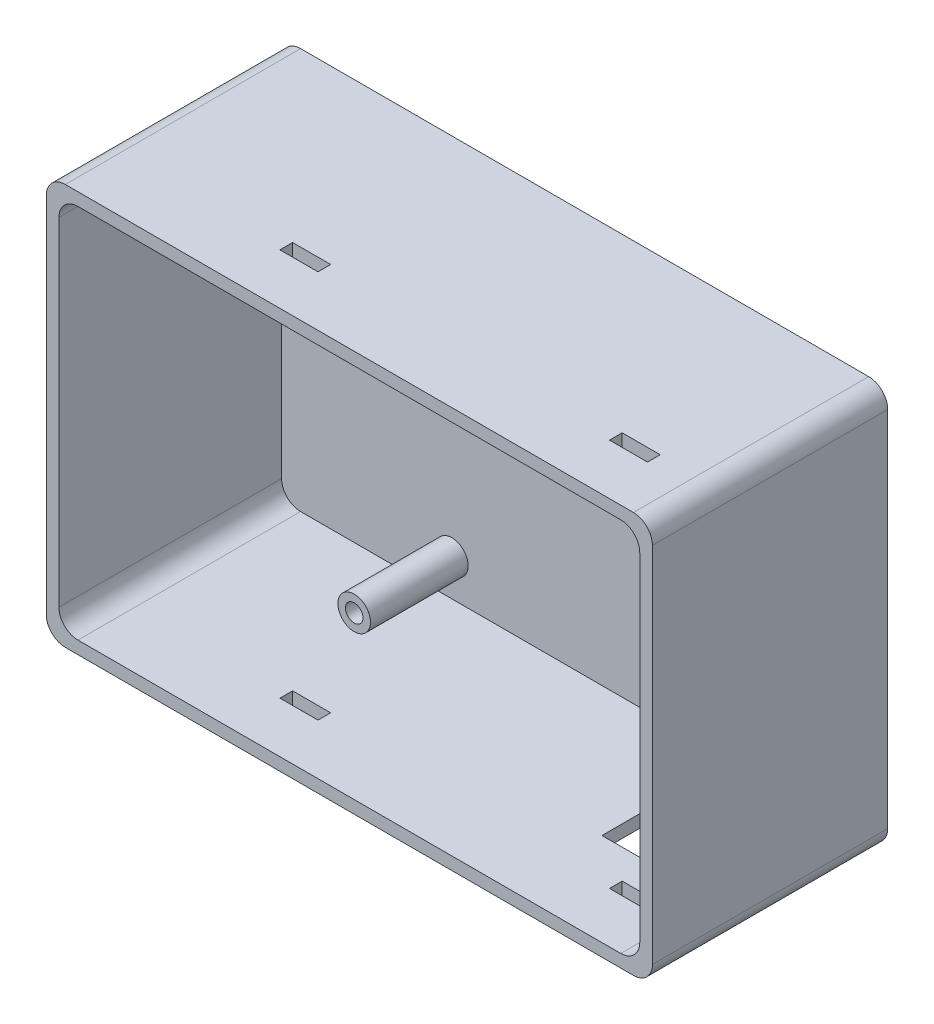
from build123d import *

# Parameters (mm, degrees)
PERIMETER_DEPTH      = 4.124453
PERIMETER_DEPTH_BACK = 31
SKETCH2_W            = 95.636537696
SKETCH2_H            = 63.255720718
SKETCH2_W_2          = 91.636537696
SKETCH2_H_2          = 59.255720718
USB_HOLE_START       = -66.6
SKETCH4_W            = 13.571838798
SKETCH4_H            = 8.15289322
USB_HOLE_DEPTH       = 81
BOTTOM_START         = -31
SKETCH2_12_W         = 95.636537696
SKETCH2_12_H         = 63.255720718
BOTTOM_DEPTH         = 2
SKETCH4_6_W          = 6
SKETCH4_6_H          = 2.002355377
LOCKING_HOLE_DEPTH   = 152
FILLET1_R            = 3
STRAWS_START         = -31
SKETCH2_14_R         = 2.578463196
SKETCH2_14_R_2       = 1.375
SKETCH2_14_R_3       = 2.558752615
SKETCH2_14_R_4       = 1.372691975
SKETCH2_14_R_5       = 2.568645486
SKETCH2_14_R_6       = 1.384737696
SKETCH2_14_R_7       = 2.568443666
SKETCH2_14_R_8       = 1.388555099
STRAWS_DEPTH         = 15.415068015
CUT_EXTRUDE3_START   = -68
SKETCH2_16_R         = 1.375
SKETCH2_16_R_2       = 1.388555099
SKETCH2_16_R_3       = 1.384737696
SKETCH2_16_R_4       = 1.372691975
CUT_EXTRUDE3_DEPTH   = 68


with BuildPart() as part:
    # Sketch2 → Perimeter (new, two sides: drawn at the far end of the back side and taken through both)
    with BuildSketch(Plane.XY.offset(-PERIMETER_DEPTH_BACK)):
        with Locations((147.401306837, -96.227860359)):
            Rectangle(SKETCH2_W, SKETCH2_H)
        with Locations((147.401306837, -96.227860359)):
            Rectangle(SKETCH2_W_2, SKETCH2_H_2, mode=Mode.SUBTRACT)
    extrude(amount=PERIMETER_DEPTH + PERIMETER_DEPTH_BACK)

    # Sketch4 → USB_Hole (cut)
    with BuildSketch(Plane(origin=(0, 0, 0), x_dir=(1, 0, 0), z_dir=(0, 1, 0)).offset(USB_HOLE_START)):
        with Locations((179.410729964, 14.588485375)):
            Rectangle(SKETCH4_W, SKETCH4_H)
    extrude(amount=-USB_HOLE_DEPTH, mode=Mode.SUBTRACT)

    # Sketch2<12> → Bottom (add)
    with BuildSketch(Plane.XY.offset(BOTTOM_START)):
        with Locations((147.401306837, -96.227860359)):
            Rectangle(SKETCH2_12_W, SKETCH2_12_H)
    extrude(amount=-BOTTOM_DEPTH)

    # Sketch4<6> → Locking_Hole (cut)
    with BuildSketch(Plane(origin=(0, 0, 0), x_dir=(1, 0, 0), z_dir=(0, 1, 0))):
        with Locations((131.455, 4.874369651)):
            Rectangle(SKETCH4_6_W, SKETCH4_6_H)
        with Locations((183.452691975, 4.874369651)):
            Rectangle(SKETCH4_6_W, SKETCH4_6_H)
    extrude(amount=-LOCKING_HOLE_DEPTH, mode=Mode.SUBTRACT)

    # Fillet1
    fillet1_edges = [part.edges().sort_by_distance(p)[0] for p in [
        (101.583037989, -125.855720718, -13.4377735),
        (101.583037989, -66.6, -13.4377735),
        (193.219575685, -66.6, -13.4377735),
        (195.219575685, -64.6, -14.4377735),
        (193.219575685, -125.855720718, -13.4377735),
        (195.219575685, -127.855720718, -14.4377735),
        (99.583037989, -64.6, -14.4377735),
        (99.583037989, -127.855720718, -14.4377735),
    ]]
    fillet(fillet1_edges, radius=FILLET1_R)

    # Sketch2<14> → Straws (add)
    # profile 1 of 4: a face of its own
    with BuildSketch(Plane.XY.offset(STRAWS_START)):
        with Locations(Location((128.455, -71.07, 0), (0, 0, 180))):
            Circle(SKETCH2_14_R)
        with Locations(Location((128.455, -71.07, 0), (0, 0, 180))):
            Circle(SKETCH2_14_R_2, mode=Mode.SUBTRACT)
    # profile 2 of 4: a face of its own
    with BuildSketch(Plane.XY.offset(STRAWS_START)):
        with Locations(Location((186.452691975, -71.07, 0), (0, 0, 180))):
            Circle(SKETCH2_14_R_3)
        with Locations(Location((186.452691975, -71.07, 0), (0, 0, 180))):
            Circle(SKETCH2_14_R_4, mode=Mode.SUBTRACT)
    # profile 3 of 4: a face of its own
    with BuildSketch(Plane.XY.offset(STRAWS_START)):
        with Locations(Location((128.455, -120.060262304, 0), (0, 0, 180))):
            Circle(SKETCH2_14_R_5)
        with Locations(Location((128.455, -120.060262304, 0), (0, 0, 180))):
            Circle(SKETCH2_14_R_6, mode=Mode.SUBTRACT)
    # profile 4 of 4: a face of its own
    with BuildSketch(Plane.XY.offset(STRAWS_START)):
        with Locations(Location((186.452691975, -120.060262304, 0), (0, 0, 180))):
            Circle(SKETCH2_14_R_7)
        with Locations(Location((186.452691975, -120.060262304, 0), (0, 0, 180))):
            Circle(SKETCH2_14_R_8, mode=Mode.SUBTRACT)
    extrude(amount=STRAWS_DEPTH)

    # Sketch2<16> → Cut-Extrude3 (cut)
    with BuildSketch(Plane.XY.offset(CUT_EXTRUDE3_START)):
        with Locations(Location((128.455, -71.07, 0), (0, 0, 180))):
            Circle(SKETCH2_16_R)
        with Locations(Location((186.452691975, -120.060262304, 0), (0, 0, 180))):
            Circle(SKETCH2_16_R_2)
        with Locations(Location((128.455, -120.060262304, 0), (0, 0, 180))):
            Circle(SKETCH2_16_R_3)
        with Locations(Location((186.452691975, -71.07, 0), (0, 0, 180))):
            Circle(SKETCH2_16_R_4)
    extrude(amount=CUT_EXTRUDE3_DEPTH, mode=Mode.SUBTRACT)


solid = part.part
